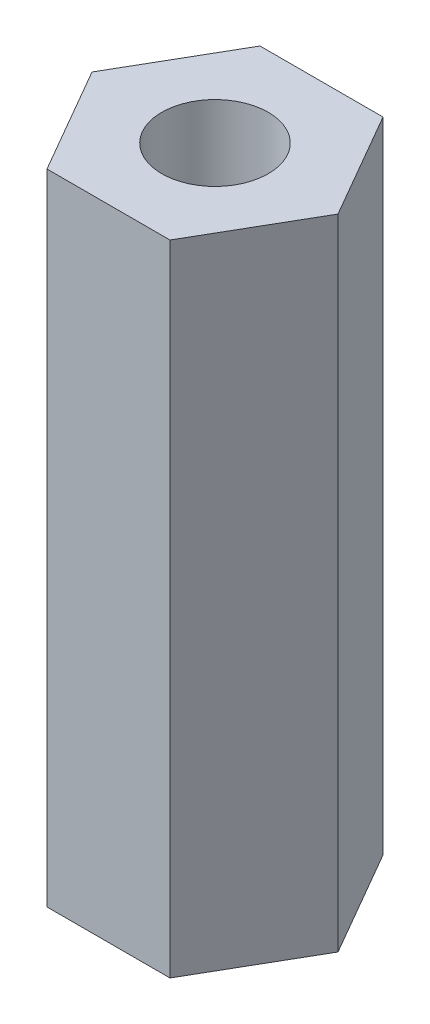
from build123d import *

# Parameters (mm, degrees)
SKETCH1_R           = 3.175
BOSS_EXTRUDE1_DEPTH = 38.1


with BuildPart() as part:
    # Sketch1 → Boss-Extrude1 (new body)
    with BuildSketch(Plane(origin=(0, 0, 0), x_dir=(1, 0, 0), z_dir=(0, 1, 0))):
        Polygon((7.332348419, 0), (3.666174209, 6.35), (-3.666174209, 6.35), (-7.332348419, 0), (-3.666174209, -6.35), (3.666174209, -6.35), align=None)
        with Locations(Location((0, 0, 0), (0, 0, 90))):
            Circle(SKETCH1_R, mode=Mode.SUBTRACT)
    extrude(amount=BOSS_EXTRUDE1_DEPTH)


solid = part.part
